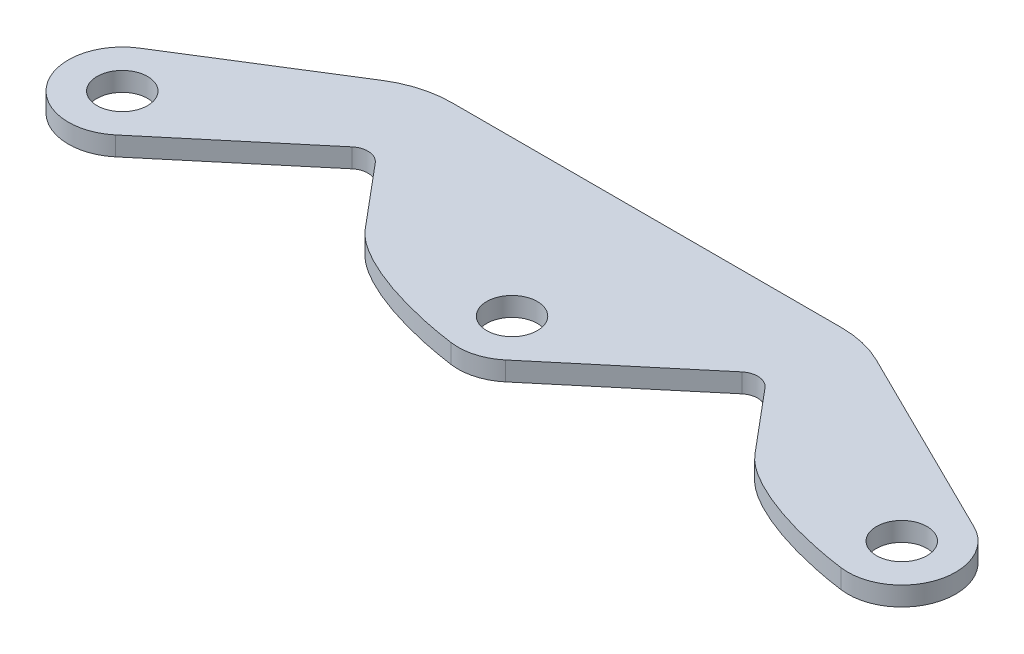
from build123d import *

# Parameters (mm, degrees)
SKETCH1_R           = 4.2164
BOSS_EXTRUDE1_DEPTH = 3.175


with BuildPart() as part:
    # Sketch1 → Boss-Extrude1 (new body)
    with BuildSketch(Plane(origin=(0, 0, 0), x_dir=(1, 0, 0), z_dir=(0, 1, 0))):
        with BuildLine():
            Line((-59.214911513, -6.894399988), (-37.765667105, 11.103653083))
            ThreePointArc((-37.765667105, 11.103653083), (-35.575837048, 11.794103848), (-33.539170947, 10.733882583))
            Line((-33.539170947, 10.733882583), (-24.735247395, 0.241775061))
            add(Edge.make_bspline(
                [(-24.735247395, 0.241775061), (-19.166526074, -6.39476858), (-1.252557909, -8.912412619)],
                knots=[0.363872068, 0.363872068, 0.363872068, 1.570796327, 1.570796327, 1.570796327], degree=2, weights=[1, 0.823375807, 1]))
            ThreePointArc((-1.252557909, -8.912412619), (8.599251475, -2.655724773), (3.991123209, 8.066655784))
            Line((3.991123209, 8.066655784), (-28.298515993, 24.042536234))
            ThreePointArc((-28.298515993, 24.042536234), (-31.966211418, 25.358907325), (-35.837304276, 25.805519754))
            Line((-35.837304276, 25.805519754), (-100.837304276, 25.805519754))
            ThreePointArc((-100.837304276, 25.805519754), (-105.526927742, 25.145881798), (-109.852615487, 23.218158783))
            Line((-109.852615487, 23.218158783), (-134.772811817, 7.630220662))
            ThreePointArc((-134.772811817, 7.630220662), (-137.279926323, -5.291755165), (-124.214911513, -6.894399988))
            Line((-124.214911513, -6.894399988), (-102.765667105, 11.103653083))
            ThreePointArc((-102.765667105, 11.103653083), (-100.575837048, 11.794103848), (-98.539170947, 10.733882583))
            Line((-98.539170947, 10.733882583), (-89.735247395, 0.241775061))
            add(Edge.make_bspline(
                [(-89.735247395, 0.241775061), (-84.166526074, -6.39476858), (-66.252557909, -8.912412619)],
                knots=[0.363872068, 0.363872068, 0.363872068, 1.570796327, 1.570796327, 1.570796327], degree=2, weights=[1, 0.823375807, 1]))
            ThreePointArc((-66.252557909, -8.912412619), (-62.519263798, -8.651355263), (-59.214911513, -6.894399988))
        make_face()
        with Locations(Location((0, 0, 0), (0, 0, 270))):
            Circle(SKETCH1_R, mode=Mode.SUBTRACT)
        with Locations(Location((-65, 0, 0), (0, 0, 270))):
            Circle(SKETCH1_R, mode=Mode.SUBTRACT)
        with Locations(Location((-130, 0, 0), (0, 0, 270))):
            Circle(SKETCH1_R, mode=Mode.SUBTRACT)
    extrude(amount=BOSS_EXTRUDE1_DEPTH)


solid = part.part
